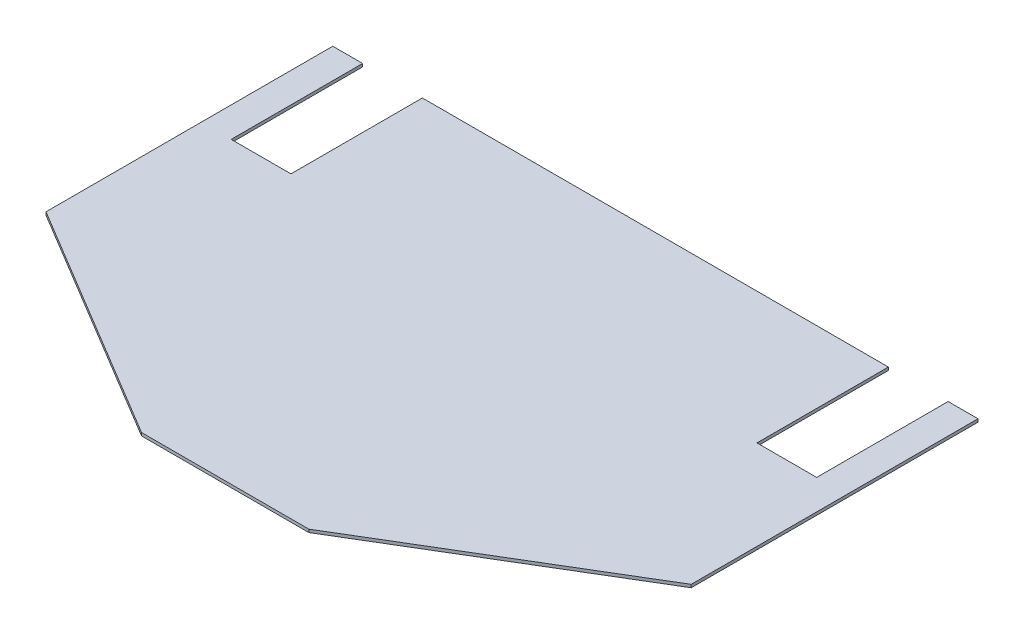
from build123d import *

# Parameters (mm, degrees)
BOSS_EXTRUDE2_DEPTH = 1.5875


with BuildPart() as part:
    # Sketch1 → Boss-Extrude2 (new body)
    with BuildSketch(Plane(origin=(0, 0, 0), x_dir=(1, 0, 0), z_dir=(0, 1, 0))):
        Polygon((-171.45, 76.2), (-44.45, 0), (0, 0), (0, 228.6), (-123.825, 228.6), (-123.825, 158.75), (-155.575, 158.75), (-155.575, 228.6), (-171.45, 228.6), align=None)
        Polygon((0, 228.6), (0, 0), (44.45, 0), (171.45, 76.2), (171.45, 228.6), (155.575, 228.6), (155.575, 158.75), (123.825, 158.75), (123.825, 228.6), align=None)
    extrude(amount=BOSS_EXTRUDE2_DEPTH)


solid = part.part
